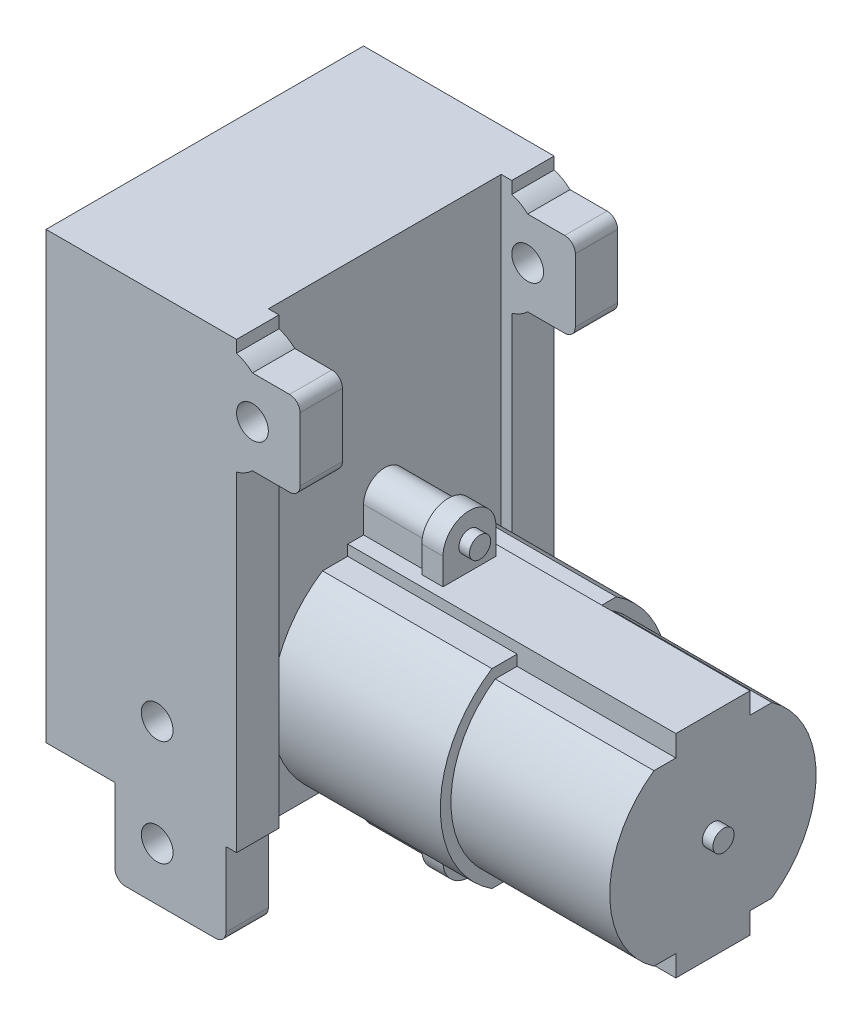
from build123d import *

# Parameters (mm, degrees)
ESQUISSE2_W             = 17
ESQUISSE2_H             = 22
BASE_DEPTH              = 42
ESQUISSE3_R             = 6
VIDE_CERCLE_DEPTH       = 2
ESQUISSE4_R             = 1
AXE_ROUE_DEPTH          = 8
ESQUISSE6_R             = 1.5
COTE_DEPTH              = 4
ESQUISSE7_W             = 10.5
ESQUISSE7_H             = 8
AJUSTE_COTE_DEPTH       = 4
ESQUISSE8_W             = 7
ESQUISSE8_H             = 1
BLOC_MOTEUR_DEPTH       = 31
VODE_START              = -15
VODE_MOTEUR_DEPTH       = 15
ESQUISSE11_R            = 1
SORTIE_AXE_MOTEUR_DEPTH = 1
VIS_MOTEUR_1_DEPTH      = 6
VIS_MOTEUR_2_DEPTH      = 2
ESQUISSE15_R            = 1
VIS_MOTEUR_3_DEPTH      = 1


with BuildPart() as part:
    # Esquisse2 → Base (new body)
    with BuildSketch(Plane(origin=(0, 0, 0), x_dir=(1, 0, 0), z_dir=(0, 1, 0))):
        with Locations((-30.697167752, 0)):
            Rectangle(ESQUISSE2_W, ESQUISSE2_H)
    extrude(amount=-BASE_DEPTH)

    # Esquisse3 → VIDE CERCLE (cut)
    with BuildSketch(Plane.ZY.offset(39.197167752)):
        with Locations((0, -8.724551396)):
            Circle(ESQUISSE3_R)
        with Locations(Location((0, -33.275448604, 0), (0, 0, 180))):
            Circle(ESQUISSE3_R)
    extrude(amount=-VIDE_CERCLE_DEPTH, mode=Mode.SUBTRACT)

    # Esquisse4 → AXE ROUE (add)
    with BuildSketch(Plane.ZY.offset(37.197167752)):
        with BuildLine():
            Line((1.785357107, -6.974551396), (-1.785357107, -6.974551396))
            ThreePointArc((-1.785357107, -6.974551396), (-2.5, -8.724551396), (-1.785357107, -10.474551396))
            Line((-1.785357107, -10.474551396), (1.785357107, -10.474551396))
            ThreePointArc((1.785357107, -10.474551396), (2.5, -8.724551396), (1.785357107, -6.974551396))
        make_face()
        with Locations((0, -8.724551396)):
            Circle(ESQUISSE4_R, mode=Mode.SUBTRACT)
    extrude(amount=AXE_ROUE_DEPTH)

    # Esquisse6 → COTE (add)
    with BuildSketch(Plane.XY.offset(11)):
        with BuildLine():
            Line((-19.697167752, -2), (-16.197167752, -2))
            ThreePointArc((-16.197167752, -2), (-15.490060971, -2.292893219), (-15.197167752, -3))
            Line((-15.197167752, -3), (-15.197167752, -9))
            ThreePointArc((-15.197167752, -9), (-15.490060971, -9.707106781), (-16.197167752, -10))
            Line((-16.197167752, -10), (-19.697167752, -10))
            ThreePointArc((-19.697167752, -10), (-20.395192088, -10.520394841), (-21.197167752, -10.859339966))
            Line((-21.197167752, -10.859339966), (-21.197167752, -42))
            Line((-21.197167752, -42), (-22.197167752, -42))
            Line((-22.197167752, -42), (-22.197167752, -49))
            ThreePointArc((-22.197167752, -49), (-22.490060971, -49.707106781), (-23.197167752, -50))
            Line((-23.197167752, -50), (-31.697167752, -50))
            ThreePointArc((-31.697167752, -50), (-32.404274533, -49.707106781), (-32.697167752, -49))
            Line((-32.697167752, -49), (-32.697167752, -42))
            Line((-32.697167752, -42), (-39.197167752, -42))
            Line((-39.197167752, -42), (-39.197167752, 0))
            Line((-39.197167752, 0), (-22.197167752, 0))
            Line((-22.197167752, 0), (-21.197167752, 0))
            Line((-21.197167752, 0), (-21.197167752, -1.140660034))
            ThreePointArc((-21.197167752, -1.140660034), (-20.395192088, -1.479605159), (-19.697167752, -2))
        make_face()
        with Locations((-19.697167752, -6)):
            Circle(ESQUISSE6_R, mode=Mode.SUBTRACT)
        with Locations((-28.697167752, -35)):
            Circle(ESQUISSE6_R, mode=Mode.SUBTRACT)
        with Locations((-28.697167752, -45)):
            Circle(ESQUISSE6_R, mode=Mode.SUBTRACT)
    cote = extrude(amount=COTE_DEPTH)

    # SYM COTE: COTE across plane
    add(cote.mirror(Plane.XY))

    # Esquisse7 → AJUSTE COTE (cut)
    with BuildSketch(Plane.XY.offset(-11)):
        with Locations((-27.447167752, -46)):
            Rectangle(ESQUISSE7_W, ESQUISSE7_H)
    extrude(amount=-AJUSTE_COTE_DEPTH, mode=Mode.SUBTRACT)

    # Esquisse8 → BLOC MOTEUR (add)
    with BuildSketch(Plane(origin=(-22.197167752, 0, 0), x_dir=(0, 0, -1), z_dir=(1, 0, 0))):
        with BuildLine():
            ThreePointArc((-5.878988008, -24), (-10.75, -33), (-5.878988008, -42))
            Line((-5.878988008, -42), (-3.5, -42))
            Line((-3.5, -42), (3.5, -42))
            Line((3.5, -42), (5.878988008, -42))
            ThreePointArc((5.878988008, -42), (10.75, -33), (5.878988008, -24))
            Line((5.878988008, -24), (3.5, -24))
            Line((3.5, -24), (-3.5, -24))
            Line((-3.5, -24), (-5.878988008, -24))
        make_face()
        with Locations((0, -42.5)):
            Rectangle(ESQUISSE8_W, ESQUISSE8_H)
        with Locations((0, -23.5)):
            Rectangle(ESQUISSE8_W, ESQUISSE8_H)
    extrude(amount=BLOC_MOTEUR_DEPTH)

    # Esquisse10 → VODE MOTEUR (cut)
    with BuildSketch(Plane(origin=(8.802832248, 0, 0), x_dir=(0, 0, -1), z_dir=(1, 0, 0)).offset(VODE_START)):
        with BuildLine():
            Line((-5.878988008, -24), (-3.5, -24))
            Line((-3.5, -24), (-3.5, -25))
            Line((-3.5, -25), (-5.573374202, -25))
            ThreePointArc((-5.573374202, -25), (-9.75, -33), (-5.573374202, -41))
            Line((-5.573374202, -41), (-3.5, -41))
            Line((-3.5, -41), (-3.5, -42))
            Line((-3.5, -42), (-5.878988008, -42))
            ThreePointArc((-5.878988008, -42), (-10.75, -33), (-5.878988008, -24))
        make_face()
        with BuildLine():
            Line((3.5, -24), (5.878988008, -24))
            ThreePointArc((5.878988008, -24), (10.75, -33), (5.878988008, -42))
            Line((5.878988008, -42), (3.5, -42))
            Line((3.5, -42), (3.5, -41))
            Line((3.5, -41), (5.573374202, -41))
            ThreePointArc((5.573374202, -41), (9.75, -33), (5.573374202, -25))
            Line((5.573374202, -25), (3.5, -25))
            Line((3.5, -25), (3.5, -24))
        make_face()
    extrude(amount=VODE_MOTEUR_DEPTH, mode=Mode.SUBTRACT)

    # Esquisse11 → SORTIE AXE MOTEUR (add)
    with BuildSketch(Plane(origin=(8.802832248, 0, 0), x_dir=(0, 0, -1), z_dir=(1, 0, 0))):
        with Locations((0, -33)):
            Circle(ESQUISSE11_R)
    extrude(amount=SORTIE_AXE_MOTEUR_DEPTH)

    # Esquisse12 → VIS MOTEUR 1 (add)
    with BuildSketch(Plane(origin=(-22.197167752, 0, 0), x_dir=(0, 0, -1), z_dir=(1, 0, 0))):
        with BuildLine():
            Line((-2, -20.5), (-2, -23))
            Line((-2, -23), (2, -23))
            Line((2, -23), (2, -20.5))
            ThreePointArc((2, -20.5), (0, -18.5), (-2, -20.5))
        make_face()
        with BuildLine():
            Line((2, -45.5), (2, -43))
            Line((2, -43), (-2, -43))
            Line((-2, -43), (-2, -45.5))
            ThreePointArc((-2, -45.5), (0, -47.5), (2, -45.5))
        make_face()
    extrude(amount=VIS_MOTEUR_1_DEPTH)

    # Esquisse14 → VIS MOTEUR 2 (add)
    with BuildSketch(Plane(origin=(-16.197167752, 0, 0), x_dir=(0, 0, -1), z_dir=(1, 0, 0))):
        with BuildLine():
            Line((-2.5, -20.5), (-2.5, -23))
            Line((-2.5, -23), (2.5, -23))
            Line((2.5, -23), (2.5, -20.5))
            ThreePointArc((2.5, -20.5), (0, -18), (-2.5, -20.5))
        make_face()
        with BuildLine():
            Line((-2.5, -43), (2.5, -43))
            Line((2.5, -43), (2.5, -45.5))
            ThreePointArc((2.5, -45.5), (0, -48), (-2.5, -45.5))
            Line((-2.5, -45.5), (-2.5, -43))
        make_face()
    extrude(amount=VIS_MOTEUR_2_DEPTH)

    # Esquisse15 → VIS MOTEUR 3 (add)
    with BuildSketch(Plane(origin=(-14.197167752, 0, 0), x_dir=(0, 0, -1), z_dir=(1, 0, 0))):
        with Locations((0, -20.5)):
            Circle(ESQUISSE15_R)
        with Locations(Location((0, -45.5, 0), (0, 0, 180))):
            Circle(ESQUISSE15_R)
    extrude(amount=VIS_MOTEUR_3_DEPTH)


solid = part.part
